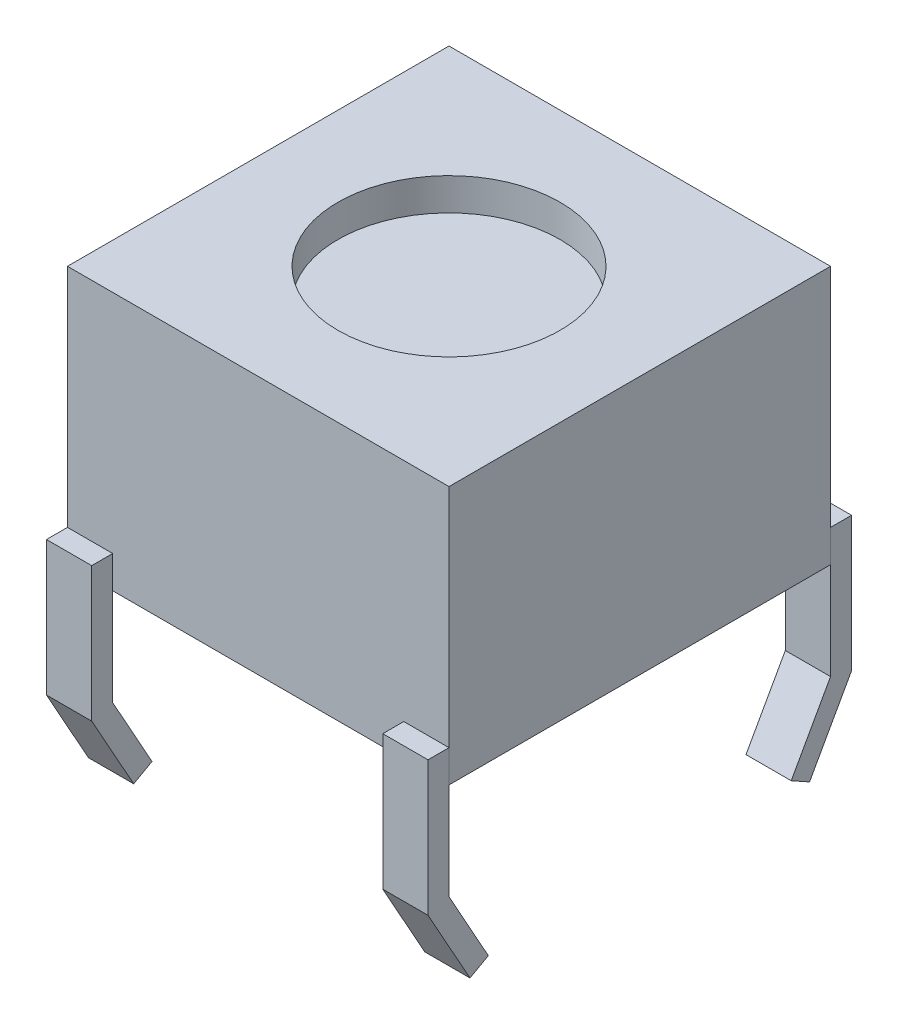
from build123d import *

# Parameters (mm, degrees)
SKETCH1_W            = 6
SKETCH1_H            = 6
BOSS_EXTRUDE1_DEPTH  = 4.064
BOSS_EXTRUDE2_DEPTH  = 0.7112
LPATTERN1_COUNT      = 2
LPATTERN1_PITCH      = 5.288799938
MIRROR1_COPY_1_DEPTH = 0.7112
SKETCH3_R            = 1.74625
CUT_EXTRUDE1_DEPTH   = 0.508


with BuildPart() as part:
    # Sketch1 → Boss-Extrude1 (new body)
    with BuildSketch(Plane(origin=(0, 0, 0), x_dir=(1, 0, 0), z_dir=(0, 1, 0))):
        Rectangle(SKETCH1_W, SKETCH1_H)
    extrude(amount=BOSS_EXTRUDE1_DEPTH)

    # Sketch2 → Boss-Extrude2 (add)
    with BuildSketch(Plane(origin=(3, 0, 0), x_dir=(0, 0, -1), z_dir=(1, 0, 0))):
        Polygon((-3, 0), (-3, -1.524), (-2.381416261, -2.633168228), (-2.6698, -2.794), (-3.3302, -1.609852), (-3.3302, 0.508), (-3, 0.508), align=None)
    boss_extrude2 = extrude(amount=-BOSS_EXTRUDE2_DEPTH)

    # LPattern1: Boss-Extrude2 ×2
    with Locations(*[(-i * LPATTERN1_PITCH, 0, 0) for i in range(1, LPATTERN1_COUNT)]):
        add(boss_extrude2)

    # Mirror1: Boss-Extrude2 across plane
    add(boss_extrude2.mirror(Plane.XY))

    # Mirror1 copy 1 sketch → Mirror1 copy 1 (add)
    with BuildSketch(Plane(origin=(-2.288799938, 0, 0), x_dir=(0, 0, 1), z_dir=(1, 0, 0))):
        Polygon((-3, 0), (-3, 1.524), (-2.381416261, 2.633168228), (-2.6698, 2.794), (-3.3302, 1.609852), (-3.3302, -0.508), (-3, -0.508), align=None)
    extrude(amount=-MIRROR1_COPY_1_DEPTH)

    # Sketch3 → Cut-Extrude1 (cut)
    with BuildSketch(Plane(origin=(0, 4.064, 0), x_dir=(1, 0, 0), z_dir=(0, 1, 0))):
        with Locations(Location((0, 0, 0), (0, 0, 270))):
            Circle(SKETCH3_R)
    extrude(amount=-CUT_EXTRUDE1_DEPTH, mode=Mode.SUBTRACT)


solid = part.part
